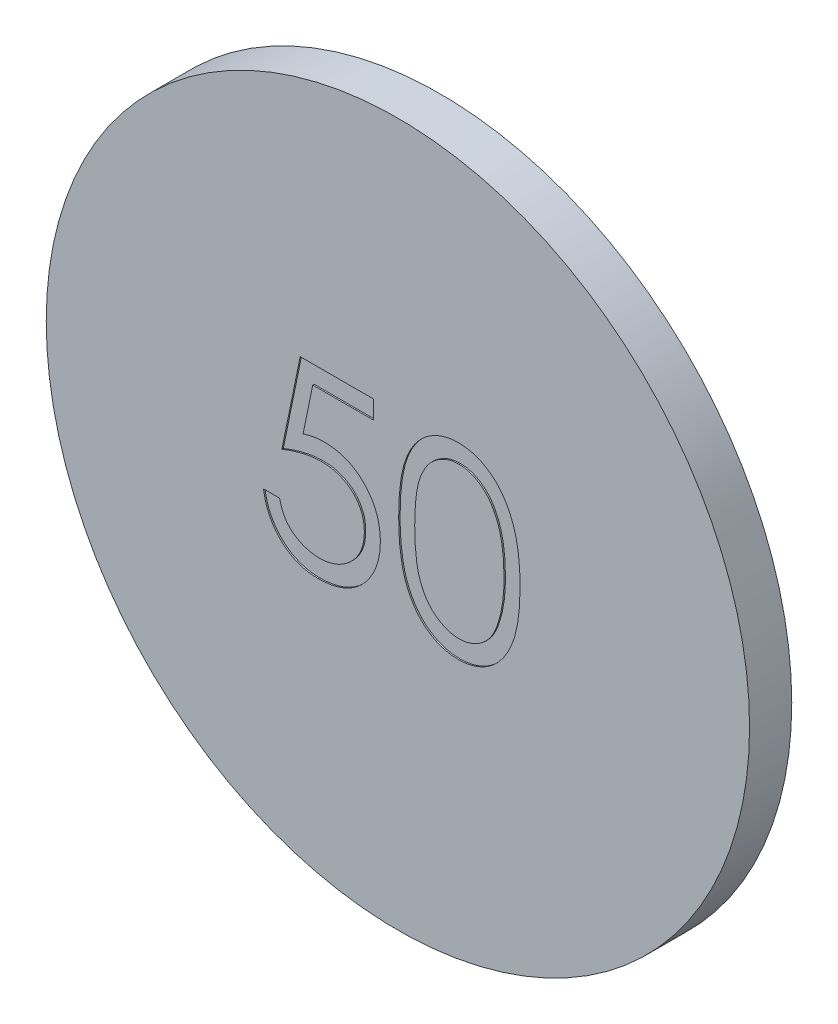
from build123d import *

# Parameters (mm, degrees)
SKETCH1_R           = 25
BOSS_EXTRUDE1_DEPTH = 3
CUT_EXTRUDE3_DEPTH  = 0.1


with BuildPart() as part:
    # Sketch1 → Boss-Extrude1 (new body)
    with BuildSketch(Plane(origin=(0, 0, 0), x_dir=(0, 1, 0), z_dir=(0, 0, 1))):
        with Locations(Location((0, 0, 0), (0, 0, 270))):
            Circle(SKETCH1_R)
    extrude(amount=BOSS_EXTRUDE1_DEPTH)

    # Sketch7 → Cut-Extrude3 (cut)
    # profile 1 of 2: a face of its own
    with BuildSketch(Plane.XY.offset(3)):
        with BuildLine():
            Line((-1.734990422, 6.841622662), (-1.734990422, 5.539058559))
            Line((-1.734990422, 5.539058559), (-6.052278083, 5.539058559))
            Line((-6.052278083, 5.539058559), (-6.739177121, 2.198693976))
            add(Edge.make_bspline(
                [(-6.739177121, 2.198693976), (-6.604717234, 2.235815248), (-6.344222469, 2.307731841), (-5.959739545, 2.387581351), (-5.59473355, 2.435715962), (-5.357877206, 2.442288432), (-5.24326366, 2.445468816)],
                knots=[0, 0, 0, 0, 1.100273476, 2.13160584, 3.095893838, 4, 4, 4, 4], degree=3))
            add(Edge.make_bspline(
                [(-5.24326366, 2.445468816), (-5.101445518, 2.442399277), (-4.82259562, 2.436363799), (-4.414602869, 2.378408802), (-4.025137799, 2.287186826), (-3.655014913, 2.159749504), (-3.303549487, 1.99679133), (-2.973975192, 1.793228689), (-2.661345051, 1.555436316), (-2.371267638, 1.282041558), (-2.108108006, 0.981154549), (-1.876728558, 0.657638845), (-1.68019573, 0.314638471), (-1.522132419, -0.051123738), (-1.395914978, -0.435604094), (-1.311906311, -0.842848037), (-1.255965681, -1.269016929), (-1.249715879, -1.560407798), (-1.246528884, -1.708998332)],
                knots=[0, 0, 0, 0, 1.052922333, 2.070308379, 3.05430497, 4.020497103, 4.973039431, 5.925935799, 6.892292201, 7.88610001, 8.88166317, 9.857072816, 10.836096531, 11.812156883, 12.81219415, 13.836441305, 14.89672472, 16, 16, 16, 16], degree=3))
            add(Edge.make_bspline(
                [(-1.246528884, -1.708998332), (-1.248942157, -1.812493246), (-1.25373609, -2.018084429), (-1.278114965, -2.323407672), (-1.325053135, -2.622267095), (-1.388073162, -2.914702345), (-1.469869936, -3.200159781), (-1.568890218, -3.479456468), (-1.690070089, -3.750854041), (-1.82298965, -4.016920475), (-1.972655442, -4.271640772), (-2.138766026, -4.509852809), (-2.314263665, -4.735130059), (-2.50309955, -4.945056462), (-2.707028875, -5.138252555), (-2.923581898, -5.315864891), (-3.151030621, -5.480897147), (-3.392893929, -5.626650312), (-3.643782367, -5.760773039), (-3.907319041, -5.87080416), (-4.177505011, -5.969176647), (-4.458228988, -6.047588362), (-4.748855108, -6.109029345), (-5.049862436, -6.150760096), (-5.359672296, -6.181154598), (-5.569675913, -6.183057264), (-5.675755647, -6.184018364)],
                knots=[0, 0, 0, 0, 1.056347294, 2.098418968, 3.122841568, 4.141288669, 5.149314143, 6.15115421, 7.162517403, 8.180376062, 9.185164535, 10.17417709, 11.141909838, 12.097768115, 13.052685741, 14.0056014, 14.954263652, 15.917497458, 16.885230207, 17.854509472, 18.828990115, 19.81800267, 20.826176721, 21.857883937, 22.917946725, 24, 24, 24, 24], degree=3))
            add(Edge.make_bspline(
                [(-5.675755647, -6.184018364), (-5.802299102, -6.181511609), (-6.051258402, -6.176579865), (-6.41600446, -6.124987075), (-6.766940315, -6.05109515), (-7.101240968, -5.939929257), (-7.42190241, -5.800638216), (-7.724607701, -5.624593822), (-8.017091517, -5.425098217), (-8.287463764, -5.189675222), (-8.538401662, -4.932352605), (-8.763033851, -4.653106307), (-8.963089972, -4.356545188), (-9.135366369, -4.041229029), (-9.282316332, -3.70798636), (-9.397759289, -3.355568614), (-9.490935034, -2.985817171), (-9.530353731, -2.731260147), (-9.550375038, -2.601967082)],
                knots=[0, 0, 0, 0, 1.0467383, 2.05933395, 3.04377827, 4.011590433, 4.970194871, 5.932262533, 6.905835911, 7.896367577, 8.894135286, 9.877477877, 10.858688626, 11.851381753, 12.8477658, 13.868841284, 14.917554742, 16, 16, 16, 16], degree=3))
            Line((-9.550375038, -2.601967082), (-8.410631448, -2.601967082))
            add(Edge.make_bspline(
                [(-8.410631448, -2.601967082), (-8.382587826, -2.723075924), (-8.328686426, -2.955853842), (-8.210374138, -3.282901852), (-8.065717961, -3.574345892), (-7.893707897, -3.834041237), (-7.688512072, -4.060496742), (-7.45436243, -4.262307224), (-7.191843548, -4.444371264), (-6.900130973, -4.596128162), (-6.592380656, -4.725554782), (-6.270282494, -4.811739504), (-5.942606723, -4.872339886), (-5.720979494, -4.87840599), (-5.609609813, -4.881454261)],
                knots=[0, 0, 0, 0, 1.136247022, 2.183929868, 3.172523383, 4.106158343, 5.02341133, 5.958108904, 6.928429099, 7.938127109, 8.96079061, 9.975095812, 10.982467395, 12, 12, 12, 12], degree=3))
            add(Edge.make_bspline(
                [(-5.609609813, -4.881454261), (-5.500903458, -4.87847601), (-5.286859755, -4.872611809), (-4.971858437, -4.827475965), (-4.667737437, -4.757961349), (-4.377497599, -4.653930733), (-4.096060013, -4.527494183), (-3.83054376, -4.365242336), (-3.573267606, -4.178515984), (-3.332228378, -3.96458764), (-3.111468091, -3.728840463), (-2.916410166, -3.476736778), (-2.753933937, -3.207798506), (-2.617013028, -2.926681637), (-2.513042486, -2.630305159), (-2.438870926, -2.320058037), (-2.39531697, -1.995173966), (-2.389325545, -1.773579614), (-2.386272474, -1.660660992)],
                knots=[0, 0, 0, 0, 1.027316725, 2.022795036, 3.002884548, 3.971462791, 4.93288096, 5.914575861, 6.907176829, 7.935150275, 8.956128384, 9.956726525, 10.942570165, 11.921478529, 12.907843606, 13.90538589, 14.932640048, 16, 16, 16, 16], degree=3))
            add(Edge.make_bspline(
                [(-2.386272474, -1.660660992), (-2.388661813, -1.558786122), (-2.393338606, -1.359380559), (-2.431549533, -1.067646295), (-2.498013975, -0.791609828), (-2.59026634, -0.529938179), (-2.707394839, -0.282384545), (-2.850528601, -0.048693441), (-3.022353788, 0.16805504), (-3.218630069, 0.367962306), (-3.433652103, 0.552456566), (-3.671119398, 0.70973368), (-3.926062561, 0.842045609), (-4.195409965, 0.956229489), (-4.485568311, 1.038237908), (-4.79079152, 1.099807092), (-5.114375575, 1.135422837), (-5.335612071, 1.140364546), (-5.449333371, 1.142904713)],
                knots=[0, 0, 0, 0, 1.045622112, 2.046656509, 3.013763289, 3.955457236, 4.890082067, 5.820317437, 6.762574623, 7.722996705, 8.69280354, 9.665887285, 10.63943826, 11.638615906, 12.663482002, 13.728887084, 14.832589034, 16, 16, 16, 16], degree=3))
            add(Edge.make_bspline(
                [(-5.449333371, 1.142904713), (-5.547772627, 1.140797996), (-5.751024716, 1.136448161), (-6.062801831, 1.104420587), (-6.390431797, 1.05275229), (-6.732658681, 0.981682192), (-7.090510239, 0.888678), (-7.463231293, 0.77722824), (-7.851605517, 0.643979845), (-8.113289831, 0.543351526), (-8.247810935, 0.491622662)],
                knots=[0, 0, 0, 0, 0.817624296, 1.688186739, 2.600797293, 3.572016777, 4.590301741, 5.671205678, 6.80286297, 8, 8, 8, 8], degree=3))
            Line((-8.247810935, 0.491622662), (-6.945246833, 6.841622662))
            Line((-6.945246833, 6.841622662), (-1.734990422, 6.841622662))
        make_face()
    # profile 2 of 2: a face of its own
    with BuildSketch(Plane.XY.offset(3)):
        with BuildLine():
            add(Edge.make_bspline(
                [(0.056035219, 0.486534521), (0.057225456, 0.690087899), (0.059537509, 1.08549327), (0.085258351, 1.661654686), (0.127986021, 2.202167735), (0.186541631, 2.707058288), (0.257799445, 3.176456691), (0.352924211, 3.609108524), (0.461102095, 4.00701624), (0.586478113, 4.371477387), (0.72794809, 4.707402195), (0.881923836, 5.021002211), (1.05451609, 5.311802937), (1.235860888, 5.584445777), (1.433298977, 5.834467755), (1.641211731, 6.065399702), (1.867713967, 6.271904425), (2.105106026, 6.460032436), (2.355537197, 6.624949091), (2.611869157, 6.770210742), (2.875866255, 6.894307403), (3.148249262, 6.991881271), (3.426569972, 7.072474915), (3.711801328, 7.127589096), (4.004414277, 7.162267021), (4.201922626, 7.16558233), (4.302088904, 7.167263687)],
                knots=[0, 0, 0, 0, 1.646270934, 3.197905019, 4.663502075, 6.030701355, 7.308322542, 8.50163776, 9.611534131, 10.641858119, 11.616356847, 12.558055219, 13.465016945, 14.349605745, 15.204443733, 16.039544428, 16.859896111, 17.680448484, 18.487036065, 19.28249412, 20.06191084, 20.843045899, 21.620316918, 22.403196591, 23.190181807, 24, 24, 24, 24], degree=3))
            add(Edge.make_bspline(
                [(4.302088904, 7.167263687), (4.403091926, 7.165493615), (4.603955159, 7.161973498), (4.900918806, 7.128140907), (5.191021937, 7.072002832), (5.473027754, 6.99246101), (5.749252705, 6.893779554), (6.017536242, 6.770092015), (6.279544795, 6.626114411), (6.531114695, 6.456936342), (6.775007728, 6.268314939), (7.005233194, 6.055090398), (7.221812048, 5.819415703), (7.427462442, 5.563812368), (7.616349895, 5.283377917), (7.796230635, 4.982989862), (7.957237736, 4.65739501), (8.112303558, 4.312025883), (8.246150624, 3.937326321), (8.366859571, 3.535408476), (8.464391829, 3.101524998), (8.545632902, 2.637952337), (8.608570096, 2.14298804), (8.65440854, 1.617693124), (8.678622306, 1.061721992), (8.683182336, 0.681600654), (8.685522398, 0.486534521)],
                knots=[0, 0, 0, 0, 0.810914788, 1.612654377, 2.396697861, 3.181598691, 3.963628158, 4.749916497, 5.551656086, 6.361998678, 7.18212741, 8.025565596, 8.878627764, 9.750805457, 10.657531673, 11.591944965, 12.560506719, 13.57287815, 14.630710178, 15.753379473, 16.941251878, 18.199788006, 19.531962791, 20.947069417, 22.433333509, 24, 24, 24, 24], degree=3))
            add(Edge.make_bspline(
                [(8.685522398, 0.486534521), (8.683158077, 0.292319198), (8.678551294, -0.086101439), (8.654679986, -0.639570978), (8.607658668, -1.162078164), (8.548839567, -1.654876128), (8.467374644, -2.115913773), (8.367207327, -2.546786486), (8.255990441, -2.949354975), (8.118704188, -3.320321291), (7.968442468, -3.6648604), (7.80495647, -3.986595481), (7.629805958, -4.288370314), (7.438983941, -4.567769396), (7.235590127, -4.826771952), (7.015271294, -5.060806183), (6.784238028, -5.275511192), (6.539627262, -5.466561383), (6.284133919, -5.633783389), (6.023025268, -5.783330789), (5.75166842, -5.903917996), (5.476212849, -6.007459431), (5.192718492, -6.086563928), (4.901538731, -6.141260489), (4.604154675, -6.179621196), (4.403126139, -6.182547566), (4.302088904, -6.184018364)],
                knots=[0, 0, 0, 0, 1.561518951, 3.042555995, 4.452378317, 5.7783523, 7.031515105, 8.214008947, 9.334062868, 10.386615937, 11.391082383, 12.354592575, 13.286541444, 14.194233754, 15.072674879, 15.931287219, 16.775624067, 17.606195743, 18.42308326, 19.229000347, 20.022332153, 20.807536673, 21.593273796, 22.3848459, 23.188221202, 24, 24, 24, 24], degree=3))
            add(Edge.make_bspline(
                [(4.302088904, -6.184018364), (4.201925405, -6.18232616), (4.004422535, -6.178989464), (3.711769449, -6.144468209), (3.427716011, -6.088967383), (3.150860532, -6.011255706), (2.879782606, -5.9161333), (2.61817608, -5.792204219), (2.363132199, -5.64947774), (2.11533141, -5.486934354), (1.87943014, -5.300709961), (1.654100915, -5.094736685), (1.445004417, -4.863874592), (1.25038927, -4.611768986), (1.06542615, -4.340739221), (0.89528471, -4.047084839), (0.737910468, -3.731970223), (0.594061231, -3.393359519), (0.466521794, -3.026311638), (0.353862968, -2.626627476), (0.264911596, -2.19077931), (0.188773444, -1.722267721), (0.127362111, -1.21907946), (0.085436417, -0.68094135), (0.059523645, -0.108188735), (0.057219247, 0.284675875), (0.056035219, 0.486534521)],
                knots=[0, 0, 0, 0, 0.810891512, 1.598919785, 2.382837074, 3.152667961, 3.926044502, 4.706494248, 5.493654104, 6.291793342, 7.103789334, 7.925228297, 8.761435821, 9.622817696, 10.50288917, 11.416980706, 12.369136599, 13.353924996, 14.394355917, 15.514179734, 16.714354668, 17.994756427, 19.357759367, 20.818452758, 22.365282078, 24, 24, 24, 24], degree=3))
        make_face()
        with BuildLine():
            add(Edge.make_bspline(
                [(1.195778808, 0.491622662), (1.196212231, 0.321991669), (1.197053418, -0.007228779), (1.219028774, -0.485631469), (1.24896533, -0.931838091), (1.287578037, -1.346415209), (1.344920165, -1.72795954), (1.409170509, -2.079095247), (1.487359292, -2.397964079), (1.579869785, -2.686754135), (1.685240222, -2.950366469), (1.800287213, -3.195662307), (1.923878979, -3.425539333), (2.06219704, -3.637932712), (2.212837412, -3.833535079), (2.372397524, -4.015808499), (2.54683233, -4.178357546), (2.78814591, -4.373309277), (3.106721688, -4.574764419), (3.508115912, -4.75019166), (3.920570005, -4.860436573), (4.200518827, -4.874456487), (4.340249962, -4.881454261)],
                knots=[0, 0, 0, 0, 1.459021318, 2.831673884, 4.118529203, 5.306027144, 6.411944654, 7.436330062, 8.375795394, 9.233974572, 10.042671642, 10.816086306, 11.563610507, 12.285937304, 12.993564865, 13.685989202, 14.367179055, 15.041617293, 16.353048772, 17.594441528, 18.799311195, 20, 20, 20, 20], degree=3))
            add(Edge.make_bspline(
                [(4.340249962, -4.881454261), (4.480884942, -4.8756566), (4.761864543, -4.864073246), (5.1723786, -4.752317828), (5.57090558, -4.583699784), (5.883223763, -4.384318836), (6.12083185, -4.194441755), (6.2910735, -4.032554317), (6.447327218, -3.851285884), (6.595525604, -3.655708439), (6.731448536, -3.442085425), (6.855049064, -3.21144408), (6.967837211, -2.96314392), (7.032095749, -2.78980801), (7.064949481, -2.701185832)],
                knots=[0, 0, 0, 0, 1.353760809, 2.704726607, 4.075137775, 5.516104923, 6.260822281, 7.007110065, 7.778089737, 8.566572457, 9.372053459, 10.217411131, 11.088608312, 12, 12, 12, 12], degree=3))
            add(Edge.make_bspline(
                [(7.064949481, -2.701185832), (7.103237325, -2.587866492), (7.180978066, -2.357779633), (7.281169361, -2.000860095), (7.360074096, -1.626381495), (7.431061166, -1.236581785), (7.479513683, -0.828586299), (7.518512891, -0.40365742), (7.541484241, 0.038525237), (7.544331766, 0.338952777), (7.545778808, 0.491622662)],
                knots=[0, 0, 0, 0, 0.884706709, 1.796334032, 2.740027952, 3.714592787, 4.726048262, 5.777819803, 6.87074269, 8, 8, 8, 8], degree=3))
            add(Edge.make_bspline(
                [(7.545778808, 0.491622662), (7.543782407, 0.644267853), (7.53987702, 0.94287448), (7.524949122, 1.380183307), (7.486400723, 1.795537754), (7.443586778, 2.190727183), (7.380459718, 2.563563996), (7.312395676, 2.917169389), (7.220951277, 3.24716265), (7.123270951, 3.558710276), (7.01147323, 3.84827265), (6.888407566, 4.117199818), (6.756974327, 4.366790105), (6.614218197, 4.596358722), (6.461833861, 4.806933949), (6.295799326, 4.994293763), (6.122700602, 5.164245048), (5.88024967, 5.358237798), (5.562842961, 5.556037379), (5.167888755, 5.738067422), (4.756878132, 5.84260037), (4.479025884, 5.857338491), (4.340249962, 5.864699585)],
                knots=[0, 0, 0, 0, 1.31362396, 2.569729283, 3.763502607, 4.902122613, 5.988968491, 7.01645872, 7.998833611, 8.933434873, 9.825090667, 10.667526885, 11.477055099, 12.250526234, 12.991942729, 13.710640831, 14.402115721, 15.076753259, 16.378508321, 17.609869233, 18.806226677, 20, 20, 20, 20], degree=3))
            add(Edge.make_bspline(
                [(4.340249962, 5.864699585), (4.199785814, 5.857328336), (3.918601625, 5.842572408), (3.503319046, 5.738456888), (3.10524897, 5.556981269), (2.788681605, 5.35758266), (2.54606158, 5.167669359), (2.375218664, 5.002981368), (2.215031125, 4.822836388), (2.06746547, 4.625435154), (1.929255785, 4.413289393), (1.802324682, 4.184730161), (1.6879618, 3.938599211), (1.582426483, 3.675105288), (1.489633795, 3.386340147), (1.413092843, 3.067864084), (1.342382679, 2.71784522), (1.29232556, 2.334234434), (1.247825646, 1.919553477), (1.219227612, 1.472232922), (1.196979907, 0.993027885), (1.196187193, 0.662105224), (1.195778808, 0.491622662)],
                knots=[0, 0, 0, 0, 1.207732386, 2.417664972, 3.655092373, 4.956220595, 5.625982001, 6.301752483, 6.994047911, 7.697131622, 8.419323945, 9.170223765, 9.943494443, 10.752040957, 11.610060368, 12.549350801, 13.567764191, 14.679664412, 15.874934091, 17.154273443, 18.533957287, 20, 20, 20, 20], degree=3))
        make_face(mode=Mode.SUBTRACT)
    extrude(amount=-CUT_EXTRUDE3_DEPTH, mode=Mode.SUBTRACT)


solid = part.part
